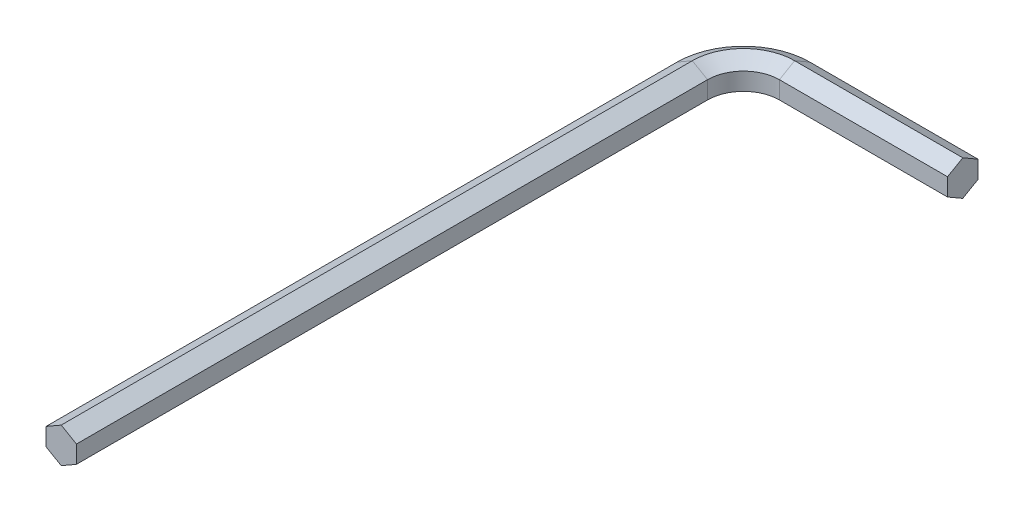
from build123d import *


with BuildPart() as part:
    # Sweep1: sweep along a path in Sketch1
    with BuildLine(Plane(origin=(0, 0, 0), x_dir=(1, 0, 0), z_dir=(0, 1, 0))) as sweep1_path:
        Line((0, 0), (0, 51.8))
        ThreePointArc((0, 51.8), (1.230151519, 54.769848481), (4.2, 56))
        Line((4.2, 56), (18, 56))
    # Sketch2 → Sweep1 (sweep)
    with BuildSketch(Plane.XY):
        Polygon((0, -1.443375673), (1.25, -0.721687836), (1.25, 0.721687836), (0, 1.443375673), (-1.25, 0.721687836), (-1.25, -0.721687836), align=None)
    sweep(path=sweep1_path.line)


solid = part.part
